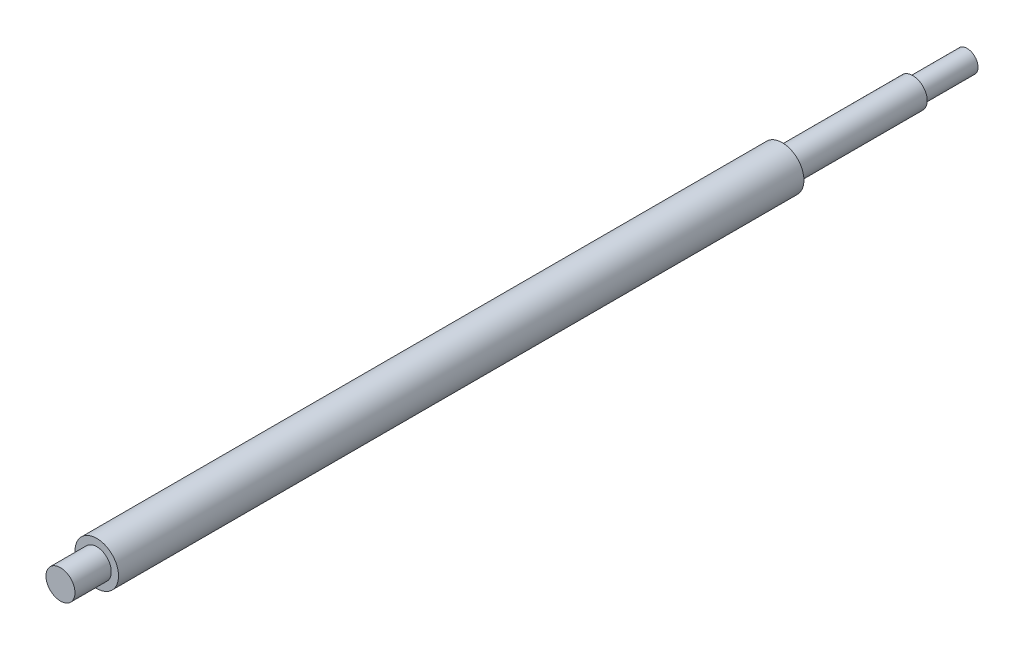
from build123d import *

# Parameters (mm, degrees)
SKETCH1_R           = 6
BOSS_EXTRUDE1_DEPTH = 250
SKETCH2_OUTSIDE_W   = 64.116
SKETCH2_OUTSIDE_H   = 64.116
SKETCH2_OUTSIDE_R   = 3
F_6MM_DEPTH         = 15
SKETCH3_OUTSIDE_W   = 64.116
SKETCH3_OUTSIDE_H   = 64.116
SKETCH3_OUTSIDE_R   = 4
F_8MM_DEPTH         = 51
SKETCH4_OUTSIDE_W   = 64.116
SKETCH4_OUTSIDE_H   = 64.116
SKETCH4_OUTSIDE_R   = 4
F_8MM_IDLE_DEPTH    = 10


with BuildPart() as part:
    # Sketch1 → Boss-Extrude1 (new body)
    with BuildSketch(Plane.XY):
        Circle(SKETCH1_R)
    extrude(amount=BOSS_EXTRUDE1_DEPTH)

    # Sketch2 outside → 6mm (cut)
    with BuildSketch(Plane(origin=(0, 0, 0), x_dir=(-1, 0, 0), z_dir=(0, 0, -1))):
        Rectangle(SKETCH2_OUTSIDE_W, SKETCH2_OUTSIDE_H)
        Circle(SKETCH2_OUTSIDE_R, mode=Mode.SUBTRACT)
    extrude(amount=-F_6MM_DEPTH, mode=Mode.SUBTRACT)

    # Sketch3 outside → 8mm (cut)
    with BuildSketch(Plane(origin=(0, 0, 0), x_dir=(-1, 0, 0), z_dir=(0, 0, -1))):
        Rectangle(SKETCH3_OUTSIDE_W, SKETCH3_OUTSIDE_H)
        Circle(SKETCH3_OUTSIDE_R, mode=Mode.SUBTRACT)
    extrude(amount=-F_8MM_DEPTH, mode=Mode.SUBTRACT)

    # Sketch4 outside → 8mm-Idle (cut)
    with BuildSketch(Plane.XY.offset(250)):
        Rectangle(SKETCH4_OUTSIDE_W, SKETCH4_OUTSIDE_H)
        with Locations(Location((0, 0, 0), (0, 0, 180))):
            Circle(SKETCH4_OUTSIDE_R, mode=Mode.SUBTRACT)
    extrude(amount=-F_8MM_IDLE_DEPTH, mode=Mode.SUBTRACT)


solid = part.part
